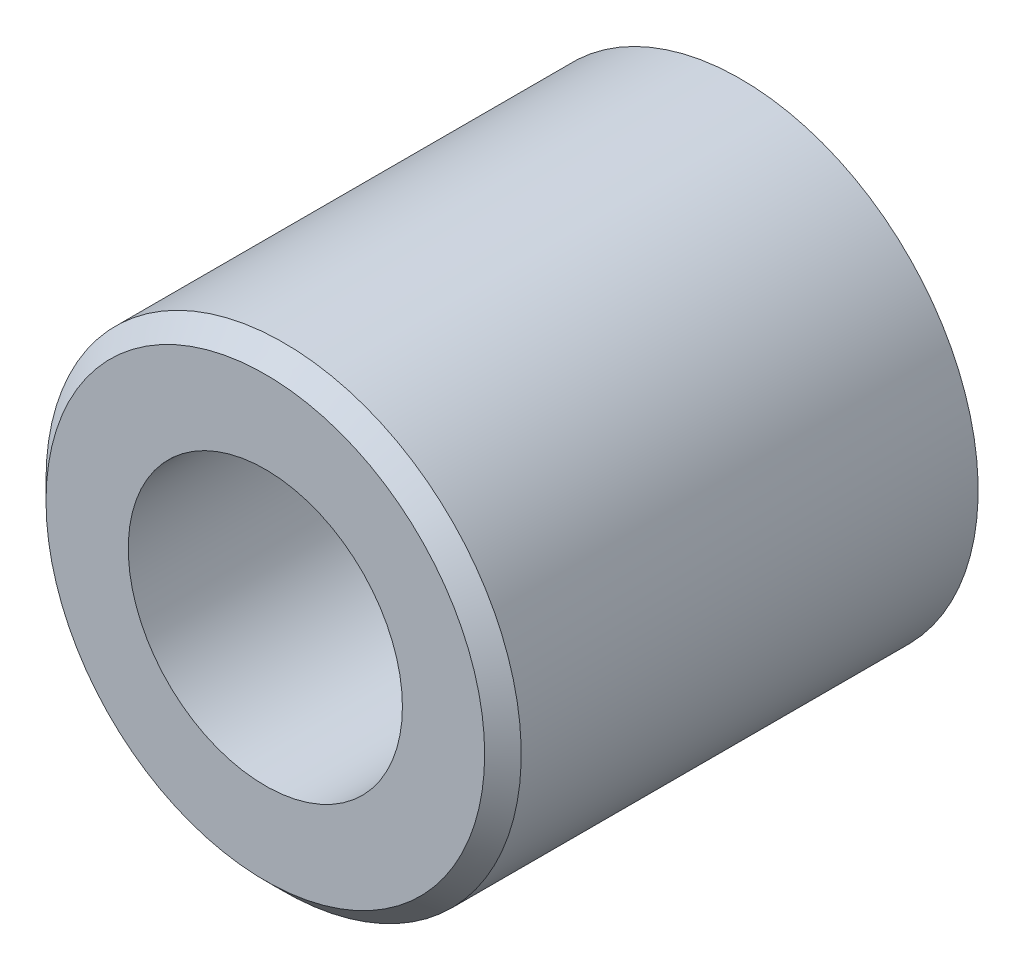
from build123d import *

# Parameters (mm, degrees)
SKETCH_1_R          = 6.5
EXTRUDE_192_DEPTH   = 13
SKETCH_2_R          = 3
CUT_EXTRUDE_1_DEPTH = 16.921683328
SKETCH_3_R          = 3.75
CUT_EXTRUDE_2_DEPTH = 8
CHAMFER_1_SIZE      = 0.5


with BuildPart() as part:
    # Эскиз1 → Extrude 192 (new body)
    with BuildSketch(Plane.XY):
        with Locations(Location((0, 0, 0), (0, 0, 180))):
            Circle(SKETCH_1_R)
    extrude(amount=EXTRUDE_192_DEPTH)

    # Эскиз2 → Вырез-Вытянуть1 (cut, through all)
    with BuildSketch(Plane.XY.offset(13)):
        Circle(SKETCH_2_R)
    extrude(amount=-CUT_EXTRUDE_1_DEPTH, mode=Mode.SUBTRACT)

    # Эскиз3 → Вырез-Вытянуть2 (cut)
    with BuildSketch(Plane.XY.offset(13)):
        Circle(SKETCH_3_R)
    extrude(amount=-CUT_EXTRUDE_2_DEPTH, mode=Mode.SUBTRACT)

    # Фаска1
    chamfer_1_edges = [part.edges().sort_by_distance(p)[0] for p in [
        (6.5, 0, 13),
    ]]
    chamfer(chamfer_1_edges, length=CHAMFER_1_SIZE)


solid = part.part
